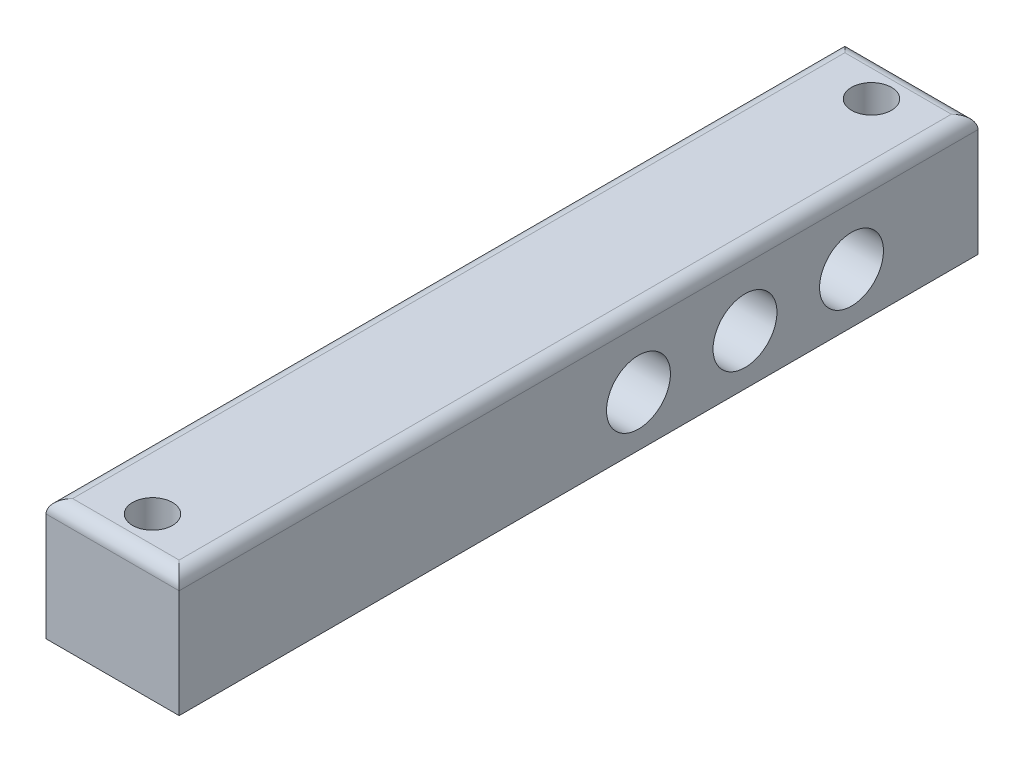
from build123d import *

# Parameters (mm, degrees)
CROQUIS1_W              = 10
CROQUIS1_H              = 60
SALIENTE_EXTRUIR1_DEPTH = 9.12
CROQUIS2_R              = 2.4
CORTAR_EXTRUIR1_DEPTH   = 62.507514988
CROQUIS4_R              = 1.5
CORTAR_EXTRUIR2_DEPTH   = 62.507514988
REDONDEO1_R             = 1


with BuildPart() as part:
    # Croquis1 → Saliente-Extruir1 (new body)
    with BuildSketch(Plane(origin=(0, 0, 0), x_dir=(1, 0, 0), z_dir=(0, 1, 0))):
        with Locations((-5, -30)):
            Rectangle(CROQUIS1_W, CROQUIS1_H)
    extrude(amount=SALIENTE_EXTRUIR1_DEPTH)

    # Croquis2 → Cortar-Extruir1 (cut, through all)
    with BuildSketch(Plane.ZY.offset(10)):
        with Locations((17.5, 3.79)):
            Circle(CROQUIS2_R)
        with Locations((9.5, 3.79)):
            Circle(CROQUIS2_R)
        with Locations((25.5, 3.79)):
            Circle(CROQUIS2_R)
    extrude(amount=-CORTAR_EXTRUIR1_DEPTH, mode=Mode.SUBTRACT)

    # Croquis4 → Cortar-Extruir2 (cut, through all)
    with BuildSketch(Plane(origin=(0, 9.12, 0), x_dir=(1, 0, 0), z_dir=(0, 1, 0))):
        with Locations(Location((-5, -3, 0), (0, 0, 270))):
            Circle(CROQUIS4_R)
        with Locations(Location((-5, -57, 0), (0, 0, 270))):
            Circle(CROQUIS4_R)
    extrude(amount=-CORTAR_EXTRUIR2_DEPTH, mode=Mode.SUBTRACT)

    # Redondeo1
    redondeo1_edges = [part.edges().sort_by_distance(p)[0] for p in [
        (0, 9.12, 30),
        (-5, 9.12, 0),
        (-10, 9.12, 30),
        (-5, 9.12, 60),
    ]]
    fillet(redondeo1_edges, radius=REDONDEO1_R)


solid = part.part
